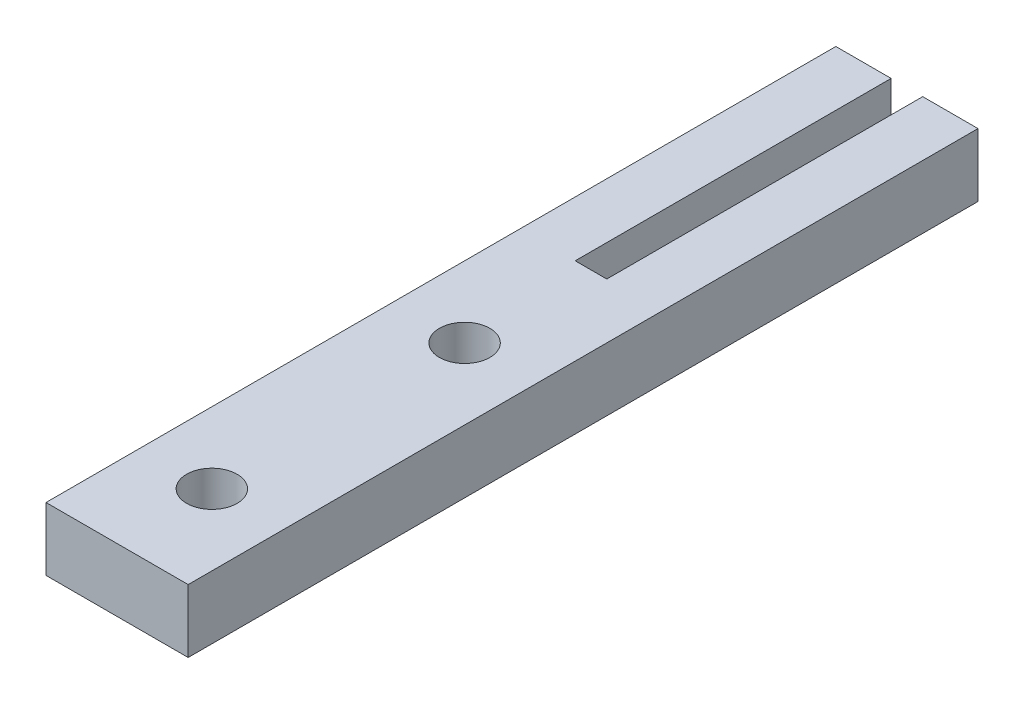
from build123d import *

# Parameters (mm, degrees)
SKETCH1_R               = 1.6
BOSS_EXTRUDE1_DEPTH     = 4
CUT_EXTRUDE1_DEPTH      = 29.640006983
CUT_EXTRUDE1_DEPTH_BACK = 2


with BuildPart() as part:
    # Sketch1 → Boss-Extrude1 (new body)
    with BuildSketch(Plane(origin=(0, 0, 0), x_dir=(1, 0, 0), z_dir=(0, 1, 0))):
        Polygon((0, -22), (-4.5, -22), (-4.5, 28), (4.5, 28), (4.5, -22), align=None)
        with Locations(Location((0, -16, 0), (0, 0, 270))):
            Circle(SKETCH1_R, mode=Mode.SUBTRACT)
        with Locations(Location((0, 0, 0), (0, 0, 270))):
            Circle(SKETCH1_R, mode=Mode.SUBTRACT)
    extrude(amount=BOSS_EXTRUDE1_DEPTH)

    # Sketch2 → Cut-Extrude1 (cut, two sides: drawn at the far end of the back side and taken through both)
    with BuildSketch(Plane(origin=(0, 4, 0), x_dir=(1, 0, 0), z_dir=(0, 1, 0)).offset(-CUT_EXTRUDE1_DEPTH_BACK)):
        Polygon((-1, 138.603180864), (-1, 28), (-1, 8), (1, 8), (1, 28), (1, 138.603180864), (1, 359.809542593), (-1, 359.809542593), align=None)
    extrude(amount=CUT_EXTRUDE1_DEPTH + CUT_EXTRUDE1_DEPTH_BACK, mode=Mode.SUBTRACT)


solid = part.part
